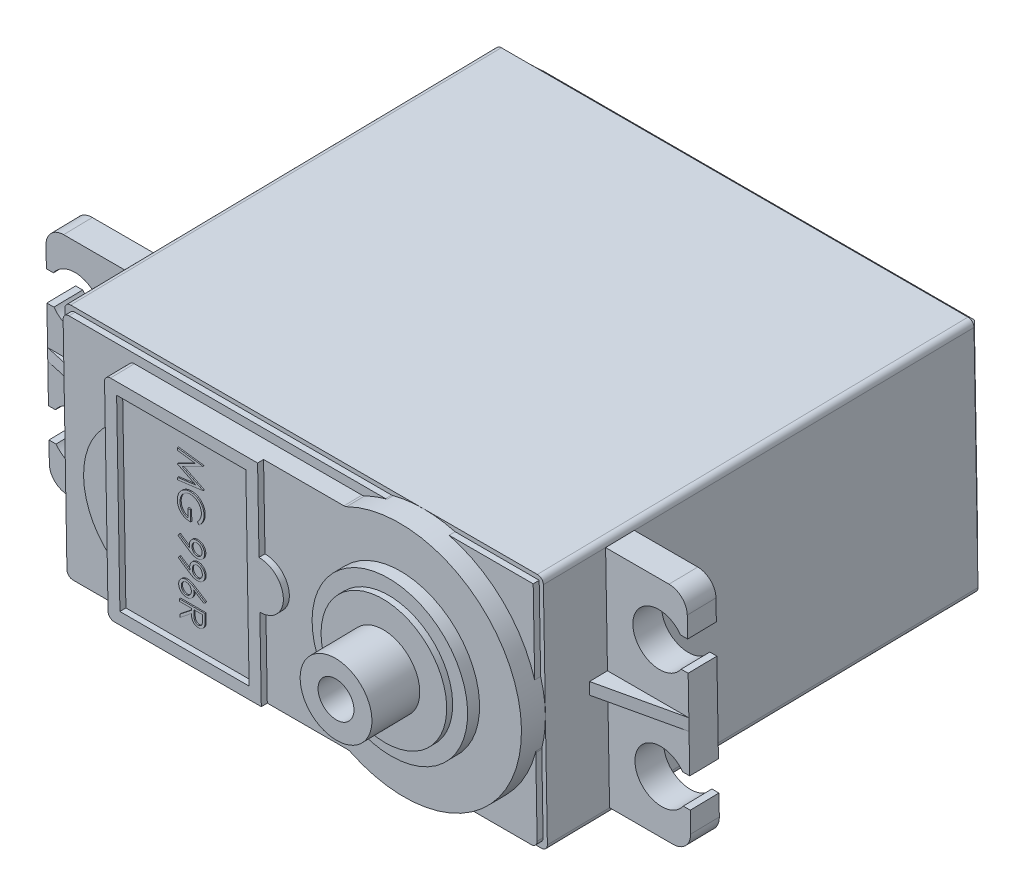
from build123d import *

# Parameters (mm, degrees)
SKETCH2_W                 = 40
SKETCH2_H                 = 20
BOSS_EXTRUDE1_DEPTH       = 38
BOSS_EXTRUDE2_DEPTH       = 2
BOSS_EXTRUDE3_DEPTH       = 0.5
SKETCH5_W                 = 12.8
SKETCH5_H                 = 17.8
SKETCH5_W_2               = 10.8
SKETCH5_H_2               = 15.8
BOSS_EXTRUDE4_DEPTH       = 0.5
BOSS_EXTRUDE5_DEPTH       = 0.5
SKETCH7_R                 = 6.5
BOSS_EXTRUDE6_DEPTH       = 1
SKETCH8_R                 = 5.25
BOSS_EXTRUDE7_DEPTH       = 0.5
SKETCH9_R                 = 3
BOSS_EXTRUDE8_DEPTH       = 4
SKETCH10_R                = 1.5
CUT_EXTRUDE1_DEPTH        = 10
CHAMFER1_SIZE             = 2
SKETCH11_R                = 2.828427125
CUT_EXTRUDE2_DEPTH        = 2
FILLET1_R                 = 0.5
FILLET2_R                 = 0.5
BOSS_EXTRUDE9_DEPTH       = 2.4
BOSS_EXTRUDE10_DEPTH      = 0.5
BOSS_EXTRUDE10_DEPTH_BACK = 0.5
BOSS_EXTRUDE11_DEPTH      = 0.1
FILLET3_R                 = 1.5
BODY_MOVE_COPY1_ANGLE     = 91


with BuildPart() as part:
    # Sketch2 → Boss-Extrude1 (new body)
    with BuildSketch(Plane(origin=(0, 0, 0), x_dir=(1, 0, 0), z_dir=(0, 1, 0))):
        Rectangle(SKETCH2_W, SKETCH2_H)
    extrude(amount=BOSS_EXTRUDE1_DEPTH)

    # Sketch3 → Boss-Extrude2 (add)
    with BuildSketch(Plane(origin=(0, 38, 0), x_dir=(1, 0, 0), z_dir=(0, 1, 0))):
        with BuildLine():
            ThreePointArc((5.440394754, 8.9), (0, 0), (5.440394754, -8.9))
            Line((5.440394754, -8.9), (5.440394754, 8.9))
        make_face()
        with BuildLine():
            Line((5.440394754, 8.9), (5.440394754, -8.9))
            ThreePointArc((5.440394754, -8.9), (15.215551147, -8.532175938), (20, 0))
            ThreePointArc((20, 0), (15.215551147, 8.532175938), (5.440394754, 8.9))
        make_face()
        with BuildLine():
            Line((-14.2, -5), (-14.2, -8.9))
            Line((-14.2, -8.9), (5.440394754, -8.9))
            ThreePointArc((5.440394754, -8.9), (0, 0), (5.440394754, 8.9))
            Line((5.440394754, 8.9), (-14.2, 8.9))
            Line((-14.2, 8.9), (-14.2, 5))
            ThreePointArc((-14.2, 5), (-7.418581742, 5.77726026), (-3.783333333, 0))
            ThreePointArc((-3.783333333, 0), (-7.418581742, -5.77726026), (-14.2, -5))
        make_face()
        with BuildLine():
            ThreePointArc((-14.2, 5), (-16.6, 0), (-14.2, -5))
            Line((-14.2, -5), (-14.2, 5))
        make_face()
        with BuildLine():
            Line((-14.2, 5), (-14.2, -5))
            ThreePointArc((-14.2, -5), (-7.418581742, -5.77726026), (-3.783333333, 0))
            ThreePointArc((-3.783333333, 0), (-7.418581742, 5.77726026), (-14.2, 5))
        make_face()
    extrude(amount=BOSS_EXTRUDE2_DEPTH)

    # Sketch4 → Boss-Extrude3 (add)
    with BuildSketch(Plane(origin=(0, 38, 0), x_dir=(1, 0, 0), z_dir=(0, 1, 0))):
        Polygon((-19.65, 9.65), (-19.65, -9.65), (10, -9.65), (19.65, -9.65), (19.65, 0), (19.65, 9.65), (10, 9.65), align=None)
    extrude(amount=BOSS_EXTRUDE3_DEPTH)

    # Sketch5 → Boss-Extrude4 (add)
    with BuildSketch(Plane(origin=(0, 40, 0), x_dir=(1, 0, 0), z_dir=(0, 1, 0))):
        with Locations((-7.8, 0)):
            Rectangle(SKETCH5_W, SKETCH5_H)
        with Locations((-7.8, 0)):
            Rectangle(SKETCH5_W_2, SKETCH5_H_2, mode=Mode.SUBTRACT)
    extrude(amount=BOSS_EXTRUDE4_DEPTH)

    # Sketch6 → Boss-Extrude5 (add)
    with BuildSketch(Plane(origin=(0, 40, 0), x_dir=(1, 0, 0), z_dir=(0, 1, 0))):
        with BuildLine():
            ThreePointArc((0.6, 0), (0.014213562, 1.414213562), (-1.4, 2))
            Line((-1.4, 2), (-1.4, -2))
            ThreePointArc((-1.4, -2), (0.014213562, -1.414213562), (0.6, 0))
        make_face()
    extrude(amount=BOSS_EXTRUDE5_DEPTH)

    # Sketch7 → Boss-Extrude6 (add)
    with BuildSketch(Plane(origin=(0, 40, 0), x_dir=(1, 0, 0), z_dir=(0, 1, 0))):
        with Locations(Location((10, 0, 0), (0, 0, 270))):
            Circle(SKETCH7_R)
    extrude(amount=BOSS_EXTRUDE6_DEPTH)

    # Sketch8 → Boss-Extrude7 (add)
    with BuildSketch(Plane(origin=(0, 41, 0), x_dir=(1, 0, 0), z_dir=(0, 1, 0))):
        with Locations(Location((10, 0, 0), (0, 0, 270))):
            Circle(SKETCH8_R)
    extrude(amount=BOSS_EXTRUDE7_DEPTH)

    # Sketch9 → Boss-Extrude8 (add)
    with BuildSketch(Plane(origin=(0, 41.5, 0), x_dir=(1, 0, 0), z_dir=(0, 1, 0))):
        with Locations(Location((10, 0, 0), (0, 0, 270))):
            Circle(SKETCH9_R)
    extrude(amount=BOSS_EXTRUDE8_DEPTH)

    # Sketch10 → Cut-Extrude1 (cut)
    with BuildSketch(Plane(origin=(0, 45.5, 0), x_dir=(1, 0, 0), z_dir=(0, 1, 0))):
        with Locations(Location((10, 0, 0), (0, 0, 270))):
            Circle(SKETCH10_R)
    extrude(amount=-CUT_EXTRUDE1_DEPTH, mode=Mode.SUBTRACT)

    # Chamfer1
    chamfer1_edges = [part.edges().sort_by_distance(p)[0] for p in [
        (0, 0, 10),
        (-20, 0, 0),
        (0, 0, -10),
        (20, 0, 0),
    ]]
    chamfer(chamfer1_edges, length=CHAMFER1_SIZE)

    # Sketch11 → Cut-Extrude2 (cut)
    with BuildSketch(Plane.XZ):
        with Locations((-20, 10)):
            Circle(SKETCH11_R)
        with Locations((20, 10)):
            Circle(SKETCH11_R)
        with Locations((20, -10)):
            Circle(SKETCH11_R)
        with Locations((-20, -10)):
            Circle(SKETCH11_R)
    extrude(amount=-CUT_EXTRUDE2_DEPTH, mode=Mode.SUBTRACT)

    # Fillet1
    fillet1_edges = [part.edges().sort_by_distance(p)[0] for p in [
        (20, 20, 10),
        (-20, 20, 10),
        (-20, 20, -10),
        (20, 20, -10),
    ]]
    fillet(fillet1_edges, radius=FILLET1_R)

    # Fillet2
    fillet2_edges = [part.edges().sort_by_distance(p)[0] for p in [
        (5.440394754, 39.25, 8.9),
        (5.440394754, 39.25, -8.9),
        (-14.2, 39.5, -8.9),
        (-14.2, 39.25, -5),
        (-14.2, 39.25, 5),
        (-14.2, 39.5, 8.9),
        (7.377501192, 38.25, 9.65),
        (7.377501192, 38.25, -9.65),
        (19.65, 38.25, 2.622498808),
        (12.622498808, 38.25, 9.65),
        (-19.65, 38.25, 9.65),
        (19.65, 38.25, 9.65),
        (-19.65, 38.25, -9.65),
    ]]
    fillet(fillet2_edges, radius=FILLET2_R)

    # Sketch13 → Boss-Extrude9 (add)
    with BuildSketch(Plane(origin=(0, 32.8, 0), x_dir=(1, 0, 0), z_dir=(0, 1, 0))):
        with BuildLine():
            Line((-26.210386699, -6.25), (-26.8, -6.25))
            Line((-26.8, -6.25), (-26.8, -9.5))
            Line((-26.8, -9.5), (-20, -9.5))
            Line((-20, -9.5), (-20, 9.5))
            Line((-20, 9.5), (-26.8, 9.5))
            Line((-26.8, 9.5), (-26.8, 6.25))
            Line((-26.8, 6.25), (-26.210386699, 6.25))
            ThreePointArc((-26.210386699, 6.25), (-23.745343883, 7.100339346), (-22.2, 5))
            ThreePointArc((-22.2, 5), (-22.844365081, 3.444365081), (-24.4, 2.8))
            Line((-24.4, 2.8), (-24.4, -2.8))
            ThreePointArc((-24.4, -2.8), (-22.844365081, -3.444365081), (-22.2, -5))
            ThreePointArc((-22.2, -5), (-23.745343883, -7.100339346), (-26.210386699, -6.25))
        make_face()
        with BuildLine():
            Line((-26.8, 3.75), (-26.8, -3.75))
            Line((-26.8, -3.75), (-26.210386699, -3.75))
            ThreePointArc((-26.210386699, -3.75), (-25.422252415, -3.051924026), (-24.4, -2.8))
            Line((-24.4, -2.8), (-24.4, 2.8))
            ThreePointArc((-24.4, 2.8), (-25.422252415, 3.051924026), (-26.210386699, 3.75))
            Line((-26.210386699, 3.75), (-26.8, 3.75))
        make_face()
        with BuildLine():
            Line((26.8, 9.5), (20, 9.5))
            Line((20, 9.5), (20, -9.5))
            Line((20, -9.5), (26.8, -9.5))
            Line((26.8, -9.5), (26.8, -6.25))
            Line((26.8, -6.25), (26.210386699, -6.25))
            ThreePointArc((26.210386699, -6.25), (22.451924026, -6.022252415), (24.4, -2.8))
            Line((24.4, -2.8), (24.4, 2.8))
            ThreePointArc((24.4, 2.8), (22.451924026, 6.022252415), (26.210386699, 6.25))
            Line((26.210386699, 6.25), (26.8, 6.25))
            Line((26.8, 6.25), (26.8, 9.5))
        make_face()
        with BuildLine():
            Line((26.8, -3.75), (26.8, 3.75))
            Line((26.8, 3.75), (26.210386699, 3.75))
            ThreePointArc((26.210386699, 3.75), (25.422252415, 3.051924026), (24.4, 2.8))
            Line((24.4, 2.8), (24.4, -2.8))
            ThreePointArc((24.4, -2.8), (25.422252415, -3.051924026), (26.210386699, -3.75))
            Line((26.210386699, -3.75), (26.8, -3.75))
        make_face()
    extrude(amount=-BOSS_EXTRUDE9_DEPTH)

    # Sketch14 → Boss-Extrude10 (add, two sides: drawn at the far end of the back side and taken through both)
    with BuildSketch(Plane.XY.offset(-BOSS_EXTRUDE10_DEPTH_BACK)):
        Polygon((20, 34.3), (26.8, 32.8), (20, 32.8), align=None)
        Polygon((-20, 32.8), (-26.8, 32.8), (-20, 34.3), align=None)
    extrude(amount=BOSS_EXTRUDE10_DEPTH + BOSS_EXTRUDE10_DEPTH_BACK)

    # Sketch15 → Boss-Extrude11 (add)
    # profile 1 of 6: a face of its own
    with BuildSketch(Plane(origin=(0, 40, 0), x_dir=(1, 0, 0), z_dir=(0, 1, 0))):
        Polygon((-8.561548725, 6.200747863), (-6.444882058, 5.921324119), (-6.444882058, 5.894187366), (-8.181634195, 5.020299145), (-6.444882058, 4.148530983), (-6.444882058, 4.120970219), (-8.561548725, 3.839850427), (-8.561548725, 4.030655716), (-7.038498511, 4.233333333), (-8.561548725, 4.997402511), (-8.561548725, 5.040227698), (-7.035106417, 5.807264957), (-8.561548725, 6.009518563), align=None)
    # profile 2 of 6: a face of its own
    with BuildSketch(Plane(origin=(0, 40, 0), x_dir=(1, 0, 0), z_dir=(0, 1, 0))):
        with BuildLine():
            Line((-6.806140071, 1.424679487), (-6.960480348, 1.5875))
            add(Edge.make_bspline(
                [(-6.960480348, 1.5875), (-6.932810967, 1.617141776), (-6.878278885, 1.675561142), (-6.80662192, 1.770186257), (-6.746314601, 1.86944475), (-6.696391634, 1.971860294), (-6.656919261, 2.075604624), (-6.628967869, 2.179013721), (-6.610865102, 2.280971117), (-6.608747952, 2.348670327), (-6.607702571, 2.382098024)],
                knots=[0, 0, 0, 0, 1.09204548, 2.152253107, 3.191356492, 4.216655925, 5.218178745, 6.177092199, 7.099906635, 8, 8, 8, 8], degree=3))
            add(Edge.make_bspline(
                [(-6.607702571, 2.382098024), (-6.607953073, 2.402608227), (-6.608453428, 2.44357544), (-6.61482467, 2.504429471), (-6.624016441, 2.564637149), (-6.637179143, 2.623990847), (-6.654275269, 2.682726549), (-6.674916288, 2.740713594), (-6.699763682, 2.797840051), (-6.728091949, 2.853805452), (-6.759017048, 2.908338456), (-6.793507197, 2.959627677), (-6.830503248, 3.007883988), (-6.87048222, 3.052777152), (-6.912808712, 3.094881359), (-6.958058639, 3.133649558), (-7.005903564, 3.169276199), (-7.056339068, 3.201350739), (-7.108218655, 3.229989232), (-7.161069102, 3.255321041), (-7.214835326, 3.276378841), (-7.269205905, 3.29385362), (-7.324294202, 3.307543871), (-7.380101658, 3.317338355), (-7.436818766, 3.322821216), (-7.474795627, 3.32377344), (-7.493887133, 3.324252137)],
                knots=[0, 0, 0, 0, 1.028345126, 2.054023193, 3.065714254, 4.082262095, 5.100859654, 6.132352297, 7.167492809, 8.223256921, 9.277568108, 10.309840045, 11.320860232, 12.32524711, 13.322830633, 14.313234294, 15.3114222, 16.312425732, 17.308799391, 18.282312954, 19.249923241, 20.202773571, 21.145015718, 22.094907699, 23.042283124, 24, 24, 24, 24], degree=3))
            add(Edge.make_bspline(
                [(-7.493887133, 3.324252137), (-7.513402204, 3.323791035), (-7.552379057, 3.32287009), (-7.610569839, 3.317088711), (-7.667784816, 3.306022676), (-7.724660506, 3.292391015), (-7.780460079, 3.273405367), (-7.835808383, 3.25102033), (-7.890199064, 3.224186229), (-7.943301216, 3.193217907), (-7.995020793, 3.159233867), (-8.04374052, 3.12116956), (-8.09010677, 3.080734487), (-8.133090712, 3.0364576), (-8.173841918, 2.989758138), (-8.211237688, 2.939241006), (-8.245998327, 2.885899516), (-8.277685746, 2.829652298), (-8.305993766, 2.771109663), (-8.331166312, 2.71108296), (-8.35189715, 2.649380424), (-8.368793051, 2.586326321), (-8.382642278, 2.521995819), (-8.391551921, 2.456062376), (-8.398017328, 2.389010786), (-8.398490052, 2.343811708), (-8.398728212, 2.321040331)],
                knots=[0, 0, 0, 0, 0.935842715, 1.869129955, 2.799583258, 3.728257868, 4.6712142, 5.62263184, 6.589468525, 7.576334199, 8.568768874, 9.554260682, 10.538610026, 11.516240982, 12.510802173, 13.508383516, 14.52719334, 15.561971611, 16.601598616, 17.64369662, 18.68095744, 19.719943675, 20.77263142, 21.833597991, 22.908562741, 24, 24, 24, 24], degree=3))
            add(Edge.make_bspline(
                [(-8.398728212, 2.321040331), (-8.398154549, 2.293597235), (-8.397028069, 2.239708258), (-8.388258845, 2.160492649), (-8.374562931, 2.084411739), (-8.354505447, 2.011679341), (-8.328921843, 1.942210858), (-8.298081601, 1.875752074), (-8.260802879, 1.81282455), (-8.218724818, 1.753245395), (-8.171855725, 1.698344593), (-8.121238623, 1.648893856), (-8.067368749, 1.605427514), (-8.009770291, 1.568307131), (-7.949364291, 1.536328164), (-7.885075037, 1.510826334), (-7.817631427, 1.491099952), (-7.771005497, 1.483030405), (-7.74744616, 1.478952991)],
                knots=[0, 0, 0, 0, 1.13011591, 2.219166196, 3.278784489, 4.311187005, 5.322345388, 6.325022048, 7.324448642, 8.33076908, 9.325913853, 10.293360401, 11.241630175, 12.171712957, 13.111744789, 14.052245185, 15.015830637, 16, 16, 16, 16], degree=3))
            Line((-7.74744616, 1.478952991), (-7.74744616, 2.184508547))
            Line((-7.74744616, 2.184508547), (-7.530352143, 2.184508547))
            Line((-7.530352143, 2.184508547), (-7.530352143, 1.288995726))
            add(Edge.make_bspline(
                [(-7.530352143, 1.288995726), (-7.570815244, 1.290027359), (-7.65000884, 1.292046449), (-7.765500385, 1.306209317), (-7.874582314, 1.329079303), (-7.977369505, 1.360321492), (-8.073716297, 1.400765114), (-8.163720511, 1.449976119), (-8.246800694, 1.508742116), (-8.323635092, 1.574969859), (-8.392172282, 1.649295072), (-8.452410159, 1.729709428), (-8.503151264, 1.816345785), (-8.544432712, 1.909122192), (-8.576650795, 2.00773493), (-8.599493606, 2.112412189), (-8.613179345, 2.223012014), (-8.614927941, 2.298810861), (-8.615822229, 2.33757679)],
                knots=[0, 0, 0, 0, 1.140356446, 2.231883559, 3.274166699, 4.278491846, 5.25512956, 6.21435461, 7.1637429, 8.11826594, 9.068280886, 10.0076534, 10.945064095, 11.891975133, 12.864533718, 13.863980011, 14.907571808, 16, 16, 16, 16], degree=3))
            add(Edge.make_bspline(
                [(-8.615822229, 2.33757679), (-8.615478046, 2.361471014), (-8.614799206, 2.408598126), (-8.609974811, 2.478200735), (-8.602547986, 2.545884249), (-8.591332602, 2.611638806), (-8.577595644, 2.67570628), (-8.560005105, 2.737766696), (-8.539643558, 2.798056463), (-8.516483794, 2.856668769), (-8.489649506, 2.913071614), (-8.459828914, 2.967516222), (-8.427175787, 3.020303546), (-8.391125418, 3.071074012), (-8.351947454, 3.120092155), (-8.30956337, 3.167041904), (-8.26410274, 3.212186097), (-8.231821149, 3.240465044), (-8.215555135, 3.254714209)],
                knots=[0, 0, 0, 0, 1.107784379, 2.184907829, 3.233506516, 4.263428166, 5.276301166, 6.270063455, 7.25232949, 8.225834625, 9.190232166, 10.146266622, 11.1027726, 12.066435141, 13.031522626, 14.010570082, 14.99756817, 16, 16, 16, 16], degree=3))
            add(Edge.make_bspline(
                [(-8.215555135, 3.254714209), (-8.189749549, 3.275388559), (-8.138566725, 3.316394084), (-8.056561044, 3.369176589), (-7.971651348, 3.414171723), (-7.883601263, 3.450679882), (-7.792493148, 3.479187201), (-7.698443425, 3.499631935), (-7.601330981, 3.511610629), (-7.535614369, 3.513336339), (-7.502367368, 3.514209402)],
                knots=[0, 0, 0, 0, 1.023165419, 2.029347347, 3.013907458, 3.994755782, 4.975994455, 5.96558838, 6.970761222, 8, 8, 8, 8], degree=3))
            add(Edge.make_bspline(
                [(-7.502367368, 3.514209402), (-7.477471848, 3.513886652), (-7.427997216, 3.513245255), (-7.354540612, 3.505501702), (-7.282406505, 3.494325229), (-7.211528085, 3.478136556), (-7.142220096, 3.456836256), (-7.073949701, 3.43125565), (-7.006990819, 3.401292598), (-6.941932978, 3.366330162), (-6.878813215, 3.328261658), (-6.81956397, 3.285499792), (-6.76316018, 3.240150202), (-6.710623529, 3.190930726), (-6.66172523, 3.138120193), (-6.616284106, 3.082011022), (-6.574184016, 3.022630631), (-6.536102939, 2.959773118), (-6.501895232, 2.89438185), (-6.471905615, 2.826612167), (-6.447120454, 2.756485136), (-6.426090601, 2.684526037), (-6.410539062, 2.610190217), (-6.399261012, 2.534017106), (-6.391543887, 2.455609658), (-6.390923247, 2.402610726), (-6.390608554, 2.375737847)],
                knots=[0, 0, 0, 0, 1.009014138, 2.005204323, 2.991638015, 3.967544938, 4.950092358, 5.929358695, 6.922031709, 7.921874511, 8.922406847, 9.908357674, 10.882125353, 11.855201406, 12.82437151, 13.798139189, 14.780770167, 15.773426639, 16.775664355, 17.771244468, 18.775446331, 19.789330884, 20.808771541, 21.851841802, 22.910785716, 24, 24, 24, 24], degree=3))
            add(Edge.make_bspline(
                [(-6.390608554, 2.375737847), (-6.390958132, 2.353822178), (-6.391651306, 2.31036598), (-6.396480839, 2.245703717), (-6.404050769, 2.182168228), (-6.414636047, 2.119440796), (-6.428638655, 2.057760259), (-6.445703782, 1.996939746), (-6.465461901, 1.937094288), (-6.489044269, 1.878295081), (-6.515806248, 1.820142357), (-6.545931764, 1.762313966), (-6.579934434, 1.705007169), (-6.617915639, 1.648122675), (-6.659222939, 1.59130175), (-6.705037781, 1.535443133), (-6.753553448, 1.479198495), (-6.788437435, 1.443032636), (-6.806140071, 1.424679487)],
                knots=[0, 0, 0, 0, 0.985875312, 1.954874891, 2.915472732, 3.863573565, 4.815313299, 5.759461513, 6.704487138, 7.649063459, 8.607849844, 9.583336382, 10.581114205, 11.603942397, 12.659508253, 13.739925933, 14.853076422, 16, 16, 16, 16], degree=3))
        make_face()
    # profile 3 of 6: a face of its own
    with BuildSketch(Plane(origin=(0, 40, 0), x_dir=(1, 0, 0), z_dir=(0, 1, 0))):
        with BuildLine():
            Line((-8.615822229, -0.230662393), (-8.510243303, -0.078866186))
            Line((-8.510243303, -0.078866186), (-7.649923457, -0.667394498))
            add(Edge.make_bspline(
                [(-7.649923457, -0.667394498), (-7.654515453, -0.629844386), (-7.663557348, -0.555906123), (-7.66521842, -0.481437495), (-7.666035904, -0.444788328)],
                knots=[0, 0, 0, 0, 1.015715272, 2, 2, 2, 2], degree=3))
            add(Edge.make_bspline(
                [(-7.666035904, -0.444788328), (-7.665465089, -0.422568752), (-7.664344629, -0.378953667), (-7.655513825, -0.314821021), (-7.641758816, -0.253105896), (-7.621709949, -0.194043366), (-7.596086972, -0.137686046), (-7.564874842, -0.083837274), (-7.527957379, -0.032568352), (-7.48573141, 0.015517442), (-7.439357742, 0.059248093), (-7.390278343, 0.09820904), (-7.337920379, 0.130588628), (-7.28335261, 0.157486385), (-7.225790547, 0.177885275), (-7.165889245, 0.192739763), (-7.103228871, 0.201885187), (-7.060577958, 0.202973211), (-7.038922523, 0.203525641)],
                knots=[0, 0, 0, 0, 1.060702494, 2.082066239, 3.085748733, 4.076089625, 5.054723785, 6.037561548, 7.043420247, 8.066922603, 9.088643095, 10.08373341, 11.053858765, 12.022809492, 12.983497605, 13.964038393, 14.966267459, 16, 16, 16, 16], degree=3))
            add(Edge.make_bspline(
                [(-7.038922523, 0.203525641), (-7.009308147, 0.202476721), (-6.951181135, 0.200417904), (-6.866252141, 0.183848324), (-6.785947898, 0.156597548), (-6.710479543, 0.118601339), (-6.640932686, 0.070743674), (-6.578274147, 0.013225622), (-6.523395116, -0.053602966), (-6.476221221, -0.128219711), (-6.438281485, -0.208866538), (-6.410317718, -0.293332822), (-6.393868951, -0.380971361), (-6.391700359, -0.440339428), (-6.390608554, -0.470229033)],
                knots=[0, 0, 0, 0, 1.022988612, 2.007919123, 2.978103895, 3.94594894, 4.918897164, 5.887013414, 6.875921846, 7.89917871, 8.930658928, 9.948724884, 10.967259574, 12, 12, 12, 12], degree=3))
            add(Edge.make_bspline(
                [(-6.390608554, -0.470229033), (-6.391711389, -0.499554125), (-6.393890488, -0.557497742), (-6.409989707, -0.642817912), (-6.436834093, -0.724608652), (-6.474101775, -0.802226446), (-6.521118713, -0.873720655), (-6.576681277, -0.938257711), (-6.64141553, -0.994108657), (-6.7135508, -1.041177485), (-6.791062879, -1.078955938), (-6.871969886, -1.106214213), (-6.955692458, -1.122993647), (-7.012415768, -1.125108102), (-7.041042581, -1.126175214)],
                knots=[0, 0, 0, 0, 1.026337322, 2.02794581, 3.027878252, 4.032696425, 5.033228651, 6.015458494, 7.004668777, 8.016190509, 9.023163053, 10.0152653, 10.998354841, 12, 12, 12, 12], degree=3))
            add(Edge.make_bspline(
                [(-7.041042581, -1.126175214), (-7.063265591, -1.125471359), (-7.108339407, -1.124043767), (-7.176756075, -1.113788054), (-7.246659676, -1.097177732), (-7.305904252, -1.077910467), (-7.354338889, -1.058180733), (-7.39320891, -1.041205888), (-7.43377282, -1.021448467), (-7.475732488, -0.997979546), (-7.520191871, -0.973443639), (-7.566180028, -0.945545859), (-7.613953944, -0.915135235), (-7.646154795, -0.893465055), (-7.66264381, -0.882368456)],
                knots=[0, 0, 0, 0, 1.179688711, 2.392703466, 3.66501481, 4.991562144, 5.695278944, 6.441221078, 7.243328977, 8.089575748, 8.993388627, 9.939305498, 10.944784961, 12, 12, 12, 12], degree=3))
            Line((-7.66264381, -0.882368456), (-8.615822229, -0.230662393))
        make_face()
        with BuildLine():
            add(Edge.make_bspline(
                [(-7.448941887, -0.479981303), (-7.448482036, -0.496814255), (-7.447586862, -0.529582289), (-7.442138416, -0.577586655), (-7.432477957, -0.622897959), (-7.418616989, -0.665637239), (-7.401891289, -0.706233032), (-7.380596421, -0.744040525), (-7.355186361, -0.779091361), (-7.326635542, -0.811620251), (-7.294915427, -0.840506098), (-7.261715748, -0.866234502), (-7.22689077, -0.888103036), (-7.190004368, -0.905377018), (-7.151954438, -0.919579594), (-7.112128232, -0.92938763), (-7.070733247, -0.934821013), (-7.04261263, -0.935747251), (-7.028322229, -0.936217949)],
                knots=[0, 0, 0, 0, 1.163407946, 2.26475976, 3.333800367, 4.359385343, 5.366239384, 6.363380779, 7.350133999, 8.353570782, 9.349036268, 10.310270964, 11.253520213, 12.184142, 13.120487599, 14.056272588, 15.012232024, 16, 16, 16, 16], degree=3))
            add(Edge.make_bspline(
                [(-7.028322229, -0.936217949), (-7.014025829, -0.935812995), (-6.985853018, -0.935014984), (-6.944397196, -0.92861166), (-6.904666744, -0.917349802), (-6.86645419, -0.902229162), (-6.830035937, -0.882347874), (-6.795174436, -0.858401984), (-6.761438784, -0.830511008), (-6.730566414, -0.797779052), (-6.701740554, -0.762562584), (-6.676751595, -0.724697037), (-6.655420763, -0.685121664), (-6.637969282, -0.64380493), (-6.624323924, -0.600660833), (-6.614518181, -0.55568704), (-6.609091887, -0.508663884), (-6.608171575, -0.476743724), (-6.607702571, -0.460476763)],
                knots=[0, 0, 0, 0, 0.972051712, 1.915547132, 2.843788449, 3.775556853, 4.704594175, 5.659091977, 6.648619647, 7.675179132, 8.714041218, 9.74046568, 10.755438548, 11.767722258, 12.786148662, 13.828784001, 14.893517844, 16, 16, 16, 16], degree=3))
            add(Edge.make_bspline(
                [(-6.607702571, -0.460476763), (-6.608172247, -0.444351233), (-6.609093748, -0.412713077), (-6.614508827, -0.366108536), (-6.624386378, -0.321436711), (-6.637975872, -0.278425438), (-6.65532584, -0.237195791), (-6.676751434, -0.197935219), (-6.701874032, -0.160464245), (-6.730529707, -0.12525782), (-6.761586997, -0.092596047), (-6.795027032, -0.06421388), (-6.830054393, -0.040323477), (-6.866449285, -0.020414623), (-6.904668053, -0.005301316), (-6.944396841, 0.005962506), (-6.985853111, 0.012365303), (-7.01402586, 0.013163386), (-7.028322229, 0.013568376)],
                knots=[0, 0, 0, 0, 1.099545523, 2.15729926, 3.193054709, 4.213957097, 5.228701859, 6.237665598, 7.258567987, 8.299955741, 9.329010984, 10.327149711, 11.283968076, 12.215264062, 13.149297769, 14.079795814, 15.025585048, 16, 16, 16, 16], degree=3))
            add(Edge.make_bspline(
                [(-7.028322229, 0.013568376), (-7.042623759, 0.013201935), (-7.070828993, 0.012479246), (-7.112271145, 0.005507678), (-7.151996862, -0.006151091), (-7.190392413, -0.021765675), (-7.227084442, -0.042328541), (-7.261898989, -0.067561535), (-7.295230714, -0.097137746), (-7.326561742, -0.130661808), (-7.355319486, -0.1673516), (-7.380435479, -0.206538204), (-7.401645957, -0.24754701), (-7.418664794, -0.290522377), (-7.432339467, -0.335145823), (-7.442120611, -0.381818402), (-7.447534601, -0.430385765), (-7.448468291, -0.463290849), (-7.448941887, -0.479981303)],
                knots=[0, 0, 0, 0, 0.952633368, 1.87876736, 2.791047057, 3.707742249, 4.635551637, 5.587206343, 6.568248508, 7.601284464, 8.641511608, 9.671105535, 10.699146789, 11.713763218, 12.747829548, 13.806491675, 14.887386225, 16, 16, 16, 16], degree=3))
        make_face(mode=Mode.SUBTRACT)
    # profile 4 of 6: a face of its own
    with BuildSketch(Plane(origin=(0, 40, 0), x_dir=(1, 0, 0), z_dir=(0, 1, 0))):
        with BuildLine():
            Line((-8.615822229, -1.858867521), (-8.510243303, -1.707071314))
            Line((-8.510243303, -1.707071314), (-7.649923457, -2.295599626))
            add(Edge.make_bspline(
                [(-7.649923457, -2.295599626), (-7.654515453, -2.258049515), (-7.663557348, -2.184111251), (-7.66521842, -2.109642623), (-7.666035904, -2.072993456)],
                knots=[0, 0, 0, 0, 1.015715272, 2, 2, 2, 2], degree=3))
            add(Edge.make_bspline(
                [(-7.666035904, -2.072993456), (-7.665465089, -2.05077388), (-7.664344629, -2.007158795), (-7.655513825, -1.943026149), (-7.641758816, -1.881311024), (-7.621709949, -1.822248495), (-7.596086972, -1.765891175), (-7.564874842, -1.712042402), (-7.527957379, -1.66077348), (-7.48573141, -1.612687686), (-7.439357742, -1.568957035), (-7.390278343, -1.529996088), (-7.337920379, -1.497616501), (-7.28335261, -1.470718743), (-7.225790547, -1.450319853), (-7.165889245, -1.435465365), (-7.103228871, -1.426319942), (-7.060577958, -1.425231917), (-7.038922523, -1.424679487)],
                knots=[0, 0, 0, 0, 1.060702494, 2.082066239, 3.085748733, 4.076089625, 5.054723785, 6.037561548, 7.043420247, 8.066922603, 9.088643095, 10.08373341, 11.053858765, 12.022809492, 12.983497605, 13.964038393, 14.966267459, 16, 16, 16, 16], degree=3))
            add(Edge.make_bspline(
                [(-7.038922523, -1.424679487), (-7.009308147, -1.425728407), (-6.951181135, -1.427787225), (-6.866252141, -1.444356804), (-6.785947898, -1.471607581), (-6.710479543, -1.509603789), (-6.640932686, -1.557461454), (-6.578274147, -1.614979506), (-6.523395116, -1.681808094), (-6.476221221, -1.756424839), (-6.438281485, -1.837071666), (-6.410317718, -1.92153795), (-6.393868951, -2.009176489), (-6.391700359, -2.068544556), (-6.390608554, -2.098434161)],
                knots=[0, 0, 0, 0, 1.022988612, 2.007919123, 2.978103895, 3.94594894, 4.918897164, 5.887013414, 6.875921846, 7.89917871, 8.930658928, 9.948724884, 10.967259574, 12, 12, 12, 12], degree=3))
            add(Edge.make_bspline(
                [(-6.390608554, -2.098434161), (-6.391711389, -2.127759253), (-6.393890488, -2.18570287), (-6.409989707, -2.271023041), (-6.436834093, -2.35281378), (-6.474101775, -2.430431574), (-6.521118713, -2.501925783), (-6.576681277, -2.566462839), (-6.64141553, -2.622313785), (-6.7135508, -2.669382613), (-6.791062879, -2.707161066), (-6.871969886, -2.734419341), (-6.955692458, -2.751198775), (-7.012415768, -2.75331323), (-7.041042581, -2.754380342)],
                knots=[0, 0, 0, 0, 1.026337322, 2.02794581, 3.027878252, 4.032696425, 5.033228651, 6.015458494, 7.004668777, 8.016190509, 9.023163053, 10.0152653, 10.998354841, 12, 12, 12, 12], degree=3))
            add(Edge.make_bspline(
                [(-7.041042581, -2.754380342), (-7.063265591, -2.753676488), (-7.108339407, -2.752248895), (-7.176756075, -2.741993182), (-7.246659676, -2.72538286), (-7.305904252, -2.706115595), (-7.354338889, -2.686385861), (-7.39320891, -2.669411017), (-7.43377282, -2.649653596), (-7.475732488, -2.626184674), (-7.520191871, -2.601648767), (-7.566180028, -2.573750987), (-7.613953944, -2.543340364), (-7.646154795, -2.521670183), (-7.66264381, -2.510573584)],
                knots=[0, 0, 0, 0, 1.179688711, 2.392703466, 3.66501481, 4.991562144, 5.695278944, 6.441221078, 7.243328977, 8.089575748, 8.993388627, 9.939305498, 10.944784961, 12, 12, 12, 12], degree=3))
            Line((-7.66264381, -2.510573584), (-8.615822229, -1.858867521))
        make_face()
        with BuildLine():
            add(Edge.make_bspline(
                [(-7.448941887, -2.108186432), (-7.448482036, -2.125019383), (-7.447586862, -2.157787417), (-7.442138416, -2.205791783), (-7.432477957, -2.251103087), (-7.418616989, -2.293842367), (-7.401891289, -2.33443816), (-7.380596421, -2.372245654), (-7.355186361, -2.407296489), (-7.326635542, -2.439825379), (-7.294915427, -2.468711226), (-7.261715748, -2.49443963), (-7.22689077, -2.516308164), (-7.190004368, -2.533582146), (-7.151954438, -2.547784723), (-7.112128232, -2.557592758), (-7.070733247, -2.563026141), (-7.04261263, -2.563952379), (-7.028322229, -2.564423077)],
                knots=[0, 0, 0, 0, 1.163407946, 2.26475976, 3.333800367, 4.359385343, 5.366239384, 6.363380779, 7.350133999, 8.353570782, 9.349036268, 10.310270964, 11.253520213, 12.184142, 13.120487599, 14.056272588, 15.012232024, 16, 16, 16, 16], degree=3))
            add(Edge.make_bspline(
                [(-7.028322229, -2.564423077), (-7.014025829, -2.564018123), (-6.985853018, -2.563220112), (-6.944397196, -2.556816789), (-6.904666744, -2.54555493), (-6.86645419, -2.53043429), (-6.830035937, -2.510553003), (-6.795174436, -2.486607112), (-6.761438784, -2.458716136), (-6.730566414, -2.42598418), (-6.701740554, -2.390767712), (-6.676751595, -2.352902165), (-6.655420763, -2.313326792), (-6.637969282, -2.272010058), (-6.624323924, -2.228865961), (-6.614518181, -2.183892169), (-6.609091887, -2.136869012), (-6.608171575, -2.104948853), (-6.607702571, -2.088681891)],
                knots=[0, 0, 0, 0, 0.972051712, 1.915547132, 2.843788449, 3.775556853, 4.704594175, 5.659091977, 6.648619647, 7.675179132, 8.714041218, 9.74046568, 10.755438548, 11.767722258, 12.786148662, 13.828784001, 14.893517844, 16, 16, 16, 16], degree=3))
            add(Edge.make_bspline(
                [(-6.607702571, -2.088681891), (-6.608172247, -2.072556362), (-6.609093748, -2.040918206), (-6.614508827, -1.994313664), (-6.624386378, -1.949641839), (-6.637975872, -1.906630566), (-6.65532584, -1.865400919), (-6.676751434, -1.826140347), (-6.701874032, -1.788669373), (-6.730529707, -1.753462949), (-6.761586997, -1.720801175), (-6.795027032, -1.692419008), (-6.830054393, -1.668528605), (-6.866449285, -1.648619751), (-6.904668053, -1.633506444), (-6.944396841, -1.622242622), (-6.985853111, -1.615839826), (-7.01402586, -1.615041742), (-7.028322229, -1.614636752)],
                knots=[0, 0, 0, 0, 1.099545523, 2.15729926, 3.193054709, 4.213957097, 5.228701859, 6.237665598, 7.258567987, 8.299955741, 9.329010984, 10.327149711, 11.283968076, 12.215264062, 13.149297769, 14.079795814, 15.025585048, 16, 16, 16, 16], degree=3))
            add(Edge.make_bspline(
                [(-7.028322229, -1.614636752), (-7.042623759, -1.615003193), (-7.070828993, -1.615725882), (-7.112271145, -1.62269745), (-7.151996862, -1.634356219), (-7.190392413, -1.649970803), (-7.227084442, -1.67053367), (-7.261898989, -1.695766663), (-7.295230714, -1.725342874), (-7.326561742, -1.758866936), (-7.355319486, -1.795556729), (-7.380435479, -1.834743332), (-7.401645957, -1.875752138), (-7.418664794, -1.918727506), (-7.432339467, -1.963350951), (-7.442120611, -2.010023531), (-7.447534601, -2.058590893), (-7.448468291, -2.091495978), (-7.448941887, -2.108186432)],
                knots=[0, 0, 0, 0, 0.952633368, 1.87876736, 2.791047057, 3.707742249, 4.635551637, 5.587206343, 6.568248508, 7.601284464, 8.641511608, 9.671105535, 10.699146789, 11.713763218, 12.747829548, 13.806491675, 14.887386225, 16, 16, 16, 16], degree=3))
        make_face(mode=Mode.SUBTRACT)
    # profile 5 of 6: a face of its own
    with BuildSketch(Plane(origin=(0, 40, 0), x_dir=(1, 0, 0), z_dir=(0, 1, 0))):
        with BuildLine():
            Line((-6.390608554, -4.00267094), (-6.505515738, -4.148954995))
            Line((-6.505515738, -4.148954995), (-7.360747442, -3.589683494))
            add(Edge.make_bspline(
                [(-7.360747442, -3.589683494), (-7.354812393, -3.626918852), (-7.343235409, -3.699550627), (-7.341325604, -3.773069052), (-7.340394878, -3.808897569)],
                knots=[0, 0, 0, 0, 1.025318673, 2, 2, 2, 2], degree=3))
            add(Edge.make_bspline(
                [(-7.340394878, -3.808897569), (-7.340973098, -3.83041046), (-7.342111307, -3.872757945), (-7.350870588, -3.934931583), (-7.364674346, -3.994675368), (-7.384796139, -4.051741676), (-7.410499944, -4.106335337), (-7.441305832, -4.158769643), (-7.478804506, -4.208058954), (-7.520693312, -4.254838), (-7.567088822, -4.297308673), (-7.616317249, -4.334910383), (-7.668327306, -4.366495157), (-7.723092649, -4.392121291), (-7.780528858, -4.412020908), (-7.840562447, -4.426527722), (-7.903234813, -4.435102999), (-7.945857329, -4.436267463), (-7.96750826, -4.436858974)],
                knots=[0, 0, 0, 0, 1.04369286, 2.054478336, 3.041073146, 4.015093852, 4.984733326, 5.965804835, 6.960378782, 7.985147595, 9.009457201, 10.008161701, 10.986880575, 11.956520048, 12.937015923, 13.931873656, 14.949455224, 16, 16, 16, 16], degree=3))
            add(Edge.make_bspline(
                [(-7.96750826, -4.436858974), (-7.99711171, -4.435754359), (-8.055329948, -4.43358202), (-8.140478861, -4.417768313), (-8.220947324, -4.390477389), (-8.297051566, -4.353965404), (-8.366577328, -4.306593975), (-8.429409974, -4.250456228), (-8.484177856, -4.185021503), (-8.53116094, -4.111839309), (-8.568488941, -4.032633448), (-8.596086294, -3.949583511), (-8.612576414, -3.863399366), (-8.614735314, -3.804868473), (-8.615822229, -3.775400641)],
                knots=[0, 0, 0, 0, 1.031881447, 2.029301251, 3.006342947, 3.987068354, 4.962916383, 5.929513747, 6.915671209, 7.928552063, 8.953527267, 9.960179832, 10.973036711, 12, 12, 12, 12], degree=3))
            add(Edge.make_bspline(
                [(-8.615822229, -3.775400641), (-8.614898031, -3.746918345), (-8.613067356, -3.690499904), (-8.596759349, -3.607506818), (-8.570327088, -3.527760785), (-8.5339113, -3.451822351), (-8.487916199, -3.381471818), (-8.432536151, -3.318552584), (-8.368995118, -3.263283559), (-8.29709818, -3.217530585), (-8.22033777, -3.180241787), (-8.139569144, -3.153941459), (-8.056417804, -3.136932968), (-7.999815712, -3.13517817), (-7.971324366, -3.134294872)],
                knots=[0, 0, 0, 0, 1.011913813, 2.004424092, 2.994488568, 3.992479987, 4.990471406, 5.973328987, 6.963763268, 7.974390938, 8.994854117, 9.989689954, 10.988086187, 12, 12, 12, 12], degree=3))
            add(Edge.make_bspline(
                [(-7.971324366, -3.134294872), (-7.949533912, -3.135061981), (-7.905061767, -3.136627574), (-7.83751262, -3.145970856), (-7.768666184, -3.163107575), (-7.710303241, -3.181653251), (-7.661968151, -3.20005616), (-7.623799206, -3.21711976), (-7.583491576, -3.236198945), (-7.541807919, -3.258562406), (-7.497557243, -3.28226948), (-7.452378286, -3.309962032), (-7.404620973, -3.338859636), (-7.372824895, -3.360029284), (-7.356507325, -3.370893429)],
                knots=[0, 0, 0, 0, 1.17367173, 2.395347028, 3.66355231, 4.98980831, 5.690886799, 6.447442954, 7.240630024, 8.091733897, 8.994365608, 9.943299771, 10.944512865, 12, 12, 12, 12], degree=3))
            Line((-7.356507325, -3.370893429), (-6.390608554, -4.00267094))
        make_face()
        with BuildLine():
            add(Edge.make_bspline(
                [(-7.557488895, -3.769040465), (-7.55796566, -3.752916661), (-7.558901067, -3.72128189), (-7.564184256, -3.674927657), (-7.574194451, -3.63117484), (-7.587142868, -3.589523709), (-7.604773044, -3.550408379), (-7.625934253, -3.513382659), (-7.651093547, -3.478813954), (-7.679970407, -3.447309348), (-7.711124571, -3.418380339), (-7.744693386, -3.393496667), (-7.779651265, -3.372008605), (-7.81632677, -3.354543422), (-7.854696374, -3.340941894), (-7.89458613, -3.331103581), (-7.936262846, -3.325628189), (-7.964524888, -3.324717281), (-7.978956577, -3.324252137)],
                knots=[0, 0, 0, 0, 1.129474985, 2.216020618, 3.260639938, 4.268601163, 5.26556745, 6.258792394, 7.250684778, 8.252748164, 9.247500881, 10.223461414, 11.174097059, 12.117127289, 13.062595836, 14.020469732, 14.98917545, 16, 16, 16, 16], degree=3))
            add(Edge.make_bspline(
                [(-7.978956577, -3.324252137), (-7.99325864, -3.324631912), (-8.021302855, -3.325376596), (-8.062639556, -3.332107166), (-8.102382527, -3.342461577), (-8.140560837, -3.357617691), (-8.176966227, -3.37662789), (-8.211857297, -3.400022036), (-8.245258129, -3.427404009), (-8.276326473, -3.45923501), (-8.304823113, -3.493561658), (-8.330196575, -3.529864362), (-8.351503498, -3.568027694), (-8.3683483, -3.608269417), (-8.382144594, -3.650026115), (-8.391859881, -3.693616336), (-8.397350919, -3.739078381), (-8.398263088, -3.769873979), (-8.398728212, -3.785576923)],
                knots=[0, 0, 0, 0, 0.989642335, 1.94054129, 2.892446913, 3.828371744, 4.778262963, 5.730973156, 6.732161388, 7.763274768, 8.805796303, 9.818398792, 10.825975928, 11.825728216, 12.834635236, 13.867465554, 14.912602056, 16, 16, 16, 16], degree=3))
            add(Edge.make_bspline(
                [(-8.398728212, -3.785576923), (-8.398263125, -3.801279893), (-8.397351027, -3.832075541), (-8.391859471, -3.877537221), (-8.3821461, -3.921128794), (-8.368342841, -3.962880578), (-8.351523748, -4.003140438), (-8.330063063, -4.041337176), (-8.304977385, -4.077986475), (-8.276277427, -4.112290604), (-8.24543368, -4.144254649), (-8.211554876, -4.170995277), (-8.177243536, -4.195128497), (-8.140415763, -4.213408567), (-8.10240551, -4.228733473), (-8.062633399, -4.239035642), (-8.021304467, -4.24578014), (-7.993259184, -4.24652291), (-7.978956577, -4.246901709)],
                knots=[0, 0, 0, 0, 1.087205562, 2.132157158, 3.164804748, 4.173533273, 5.173108684, 6.180507559, 7.20098426, 8.243321352, 9.274252308, 10.269075238, 11.227079059, 12.172305571, 13.108064818, 14.05980203, 15.010532752, 16, 16, 16, 16], degree=3))
            add(Edge.make_bspline(
                [(-7.978956577, -4.246901709), (-7.964504386, -4.246572792), (-7.936139434, -4.245927234), (-7.894623679, -4.238484223), (-7.854372005, -4.228431197), (-7.816291144, -4.212184586), (-7.779328009, -4.192833546), (-7.744539033, -4.168181593), (-7.710938638, -4.139917525), (-7.679763788, -4.107184991), (-7.651248732, -4.071574925), (-7.626079417, -4.033706215), (-7.604837009, -3.994089801), (-7.587113233, -3.952763953), (-7.574322825, -3.909255661), (-7.564251581, -3.864267211), (-7.55889217, -3.817223242), (-7.557962611, -3.78530596), (-7.557488895, -3.769040465)],
                knots=[0, 0, 0, 0, 0.978265087, 1.920016216, 2.851775529, 3.783928695, 4.718195979, 5.674835085, 6.667117013, 7.690134047, 8.732874136, 9.755756613, 10.767227014, 11.776017537, 12.797239016, 13.836276431, 14.897336092, 16, 16, 16, 16], degree=3))
        make_face(mode=Mode.SUBTRACT)
    # profile 6 of 6: a face of its own
    with BuildSketch(Plane(origin=(0, 40, 0), x_dir=(1, 0, 0), z_dir=(0, 1, 0))):
        with BuildLine():
            Line((-6.444882058, -4.843910256), (-6.444882058, -5.267497997))
            add(Edge.make_bspline(
                [(-6.444882058, -5.267497997), (-6.44497615, -5.295765251), (-6.445156818, -5.350041509), (-6.446164208, -5.427797725), (-6.449051557, -5.498450303), (-6.451536271, -5.561962301), (-6.456067112, -5.618332554), (-6.460397599, -5.667733916), (-6.466066432, -5.709938857), (-6.47133114, -5.735487538), (-6.473714857, -5.747055288)],
                knots=[0, 0, 0, 0, 1.410062039, 2.707475311, 3.878576406, 4.937260626, 5.877586885, 6.699081471, 7.410979367, 8, 8, 8, 8], degree=3))
            add(Edge.make_bspline(
                [(-6.473714857, -5.747055288), (-6.47754061, -5.762541472), (-6.485110501, -5.793183477), (-6.501118557, -5.83729694), (-6.519612907, -5.879351155), (-6.541503811, -5.919188304), (-6.566409445, -5.956812082), (-6.594475323, -5.992166157), (-6.625844373, -6.025048399), (-6.659715564, -6.055711822), (-6.69638443, -6.083507227), (-6.735316805, -6.107560514), (-6.776269191, -6.128157222), (-6.819384199, -6.144600194), (-6.864297363, -6.157828061), (-6.911400858, -6.167158117), (-6.960484112, -6.172752647), (-6.993962441, -6.173322278), (-7.010937747, -6.173611111)],
                knots=[0, 0, 0, 0, 1.02737288, 2.032829108, 3.019628684, 3.985738875, 4.958353778, 5.924249254, 6.890702889, 7.883913451, 8.865824512, 9.85161466, 10.829249435, 11.81541824, 12.821369441, 13.843154991, 14.906364023, 16, 16, 16, 16], degree=3))
            add(Edge.make_bspline(
                [(-7.010937747, -6.173611111), (-7.039140914, -6.17272274), (-7.094172598, -6.170989298), (-7.174037535, -6.154826651), (-7.248539397, -6.128353458), (-7.317574504, -6.091867892), (-7.379833545, -6.045426457), (-7.434332736, -5.989614413), (-7.480359785, -5.924716787), (-7.511938398, -5.864017709), (-7.532257431, -5.810373886), (-7.546625747, -5.766081324), (-7.557539871, -5.717728938), (-7.567459284, -5.666010417), (-7.575028594, -5.610526282), (-7.580404242, -5.551388264), (-7.583860825, -5.488448456), (-7.584365847, -5.445304886), (-7.584625648, -5.42311031)],
                knots=[0, 0, 0, 0, 1.260402266, 2.459371274, 3.627181936, 4.786749125, 5.93865593, 7.087644312, 8.261344208, 9.485713728, 10.136162886, 10.825977872, 11.566646758, 12.35154167, 13.181268117, 14.0701832, 15.007234106, 16, 16, 16, 16], degree=3))
            Line((-7.584625648, -5.42311031), (-8.561548725, -6.200747863))
            Line((-8.561548725, -6.200747863), (-8.561548725, -5.965845353))
            Line((-8.561548725, -5.965845353), (-7.584625648, -5.188207799))
            Line((-7.584625648, -5.188207799), (-7.584625648, -5.033867521))
            Line((-7.584625648, -5.033867521), (-8.561548725, -5.033867521))
            Line((-8.561548725, -5.033867521), (-8.561548725, -4.843910256))
            Line((-8.561548725, -4.843910256), (-6.444882058, -4.843910256))
        make_face()
        with BuildLine():
            Line((-6.661976075, -5.033867521), (-7.367531631, -5.033867521))
            Line((-7.367531631, -5.033867521), (-7.370499713, -5.421414263))
            add(Edge.make_bspline(
                [(-7.370499713, -5.421414263), (-7.370507718, -5.439508762), (-7.370523234, -5.474581056), (-7.368107951, -5.525320983), (-7.365360322, -5.572565047), (-7.361157632, -5.616132561), (-7.355741311, -5.656042924), (-7.348966269, -5.692276398), (-7.341072568, -5.724891439), (-7.328856702, -5.762931781), (-7.30949184, -5.805396659), (-7.28136548, -5.851604123), (-7.245759745, -5.890820014), (-7.205692233, -5.924631712), (-7.16073279, -5.950675332), (-7.112876995, -5.969630517), (-7.062538003, -5.981525953), (-7.027962649, -5.982940152), (-7.010513735, -5.983653846)],
                knots=[0, 0, 0, 0, 1.14660753, 2.222451964, 3.218720504, 4.145691244, 4.995719623, 5.770487122, 6.480909919, 7.121111896, 8.299844659, 9.430703709, 10.534634535, 11.641396424, 12.741395289, 13.810956493, 14.895269934, 16, 16, 16, 16], degree=3))
            add(Edge.make_bspline(
                [(-7.010513735, -5.983653846), (-6.993487039, -5.982937958), (-6.959746341, -5.981519328), (-6.910486405, -5.969607469), (-6.863661589, -5.950371559), (-6.820164404, -5.92339836), (-6.780351723, -5.890805387), (-6.746757854, -5.852096384), (-6.718624947, -5.809220786), (-6.700778337, -5.769118889), (-6.68981488, -5.733299957), (-6.68210951, -5.702195778), (-6.675866644, -5.666917132), (-6.671012934, -5.627548564), (-6.66664515, -5.584161299), (-6.663813194, -5.536636535), (-6.66210156, -5.485029152), (-6.662018877, -5.44925919), (-6.661976075, -5.430742521)],
                knots=[0, 0, 0, 0, 1.100801541, 2.181386982, 3.260112282, 4.364594493, 5.481957178, 6.577424609, 7.668452592, 8.790448866, 9.403819393, 10.091598921, 10.863153553, 11.720938239, 12.658472417, 13.685008818, 14.801622349, 16, 16, 16, 16], degree=3))
            Line((-6.661976075, -5.430742521), (-6.661976075, -5.033867521))
        make_face(mode=Mode.SUBTRACT)
    extrude(amount=BOSS_EXTRUDE11_DEPTH)

    # Fillet3
    fillet3_edges = [part.edges().sort_by_distance(p)[0] for p in [
        (-26.8, 31.6, -9.5),
        (-26.8, 31.6, 9.5),
        (26.8, 31.6, 9.5),
        (26.8, 31.6, -9.5),
    ]]
    fillet(fillet3_edges, radius=FILLET3_R)


with BuildPart() as part_1:
    # Body-Move/Copy1: moved
    add(part.part.rotate(Axis((0, 22.75, 0), (1, 0, 0)), BODY_MOVE_COPY1_ANGLE))


solid = part_1.part
